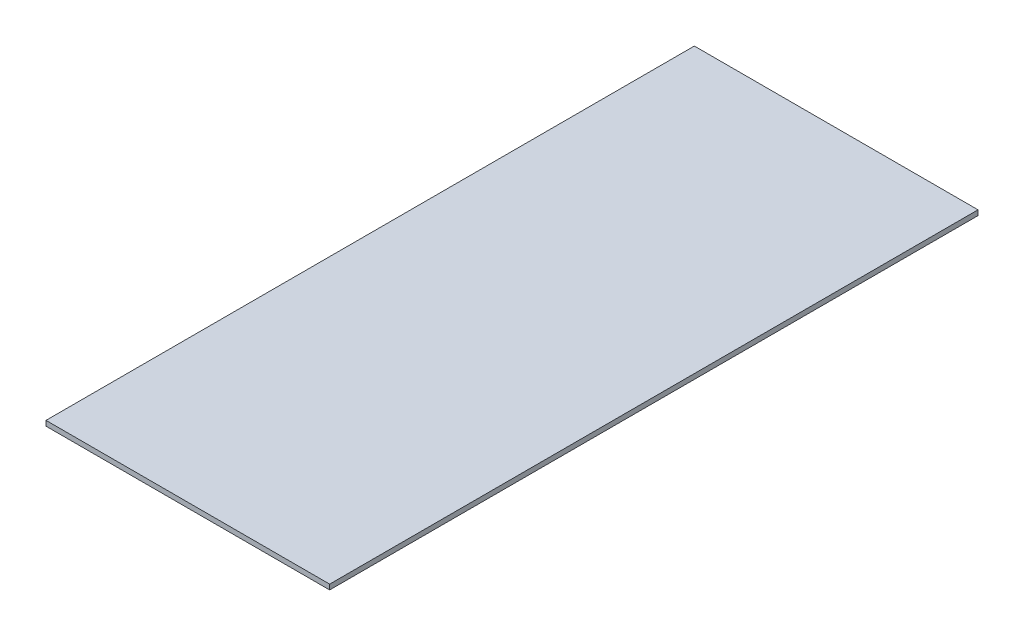
from build123d import *

# Parameters (mm, degrees)
SKETCH1_W           = 177.8
SKETCH1_H           = 406.4
BOSS_EXTRUDE1_DEPTH = 3.175


with BuildPart() as part:
    # Sketch1 → Boss-Extrude1 (new body)
    with BuildSketch(Plane(origin=(0, 0, 0), x_dir=(1, 0, 0), z_dir=(0, 1, 0))):
        Rectangle(SKETCH1_W, SKETCH1_H)
    extrude(amount=BOSS_EXTRUDE1_DEPTH)


solid = part.part
